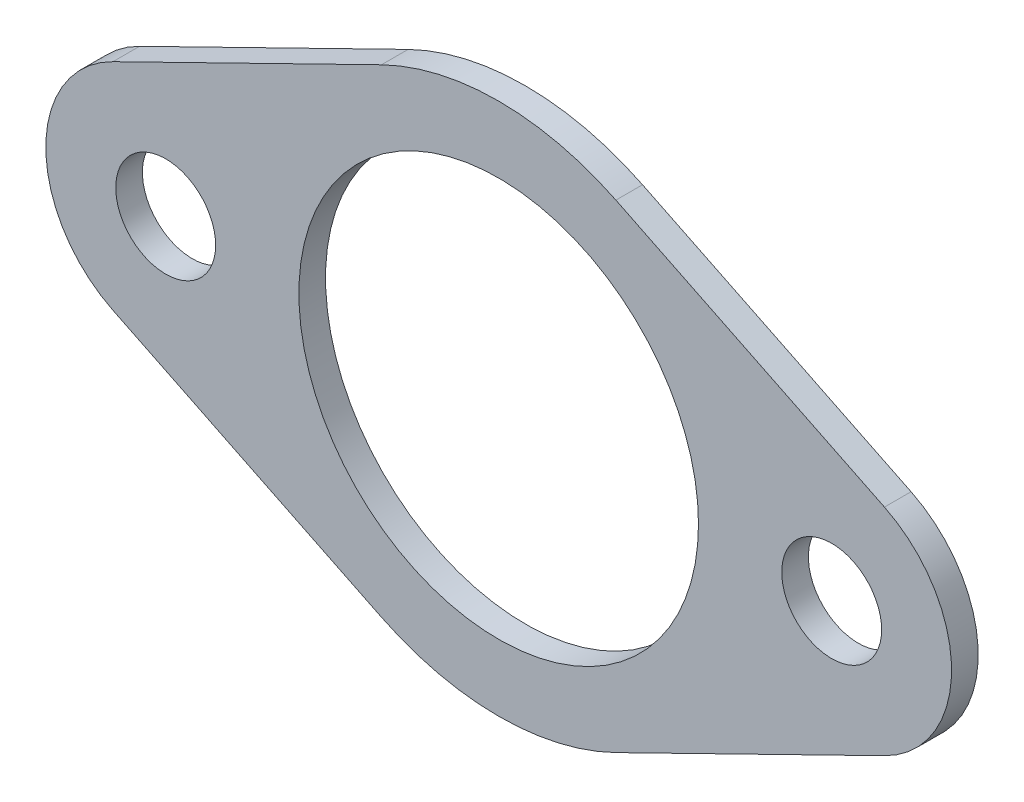
from build123d import *

# Parameters (mm, degrees)
SKETCH1_R           = 38.1
SKETCH1_R_2         = 9.525
BOSS_EXTRUDE1_DEPTH = 5.08


with BuildPart() as part:
    # Sketch1 → Boss-Extrude1 (new body)
    with BuildSketch(Plane.XY):
        with BuildLine():
            Line((-22.352, 45.61828686), (-73.5584, 20.528229087))
            ThreePointArc((-73.5584, 20.528229087), (-86.36, 0), (-73.5584, -20.528229087))
            Line((-73.5584, -20.528229087), (-22.352, -45.61828686))
            ThreePointArc((-22.352, -45.61828686), (0, -50.8), (22.352, -45.61828686))
            Line((22.352, -45.61828686), (73.5584, -20.528229087))
            ThreePointArc((73.5584, -20.528229087), (86.36, 0), (73.5584, 20.528229087))
            Line((73.5584, 20.528229087), (22.352, 45.61828686))
            ThreePointArc((22.352, 45.61828686), (0, 50.8), (-22.352, 45.61828686))
        make_face()
        Circle(SKETCH1_R, mode=Mode.SUBTRACT)
        with Locations((-63.5, 0)):
            Circle(SKETCH1_R_2, mode=Mode.SUBTRACT)
        with Locations((63.5, 0)):
            Circle(SKETCH1_R_2, mode=Mode.SUBTRACT)
    extrude(amount=BOSS_EXTRUDE1_DEPTH)


solid = part.part
